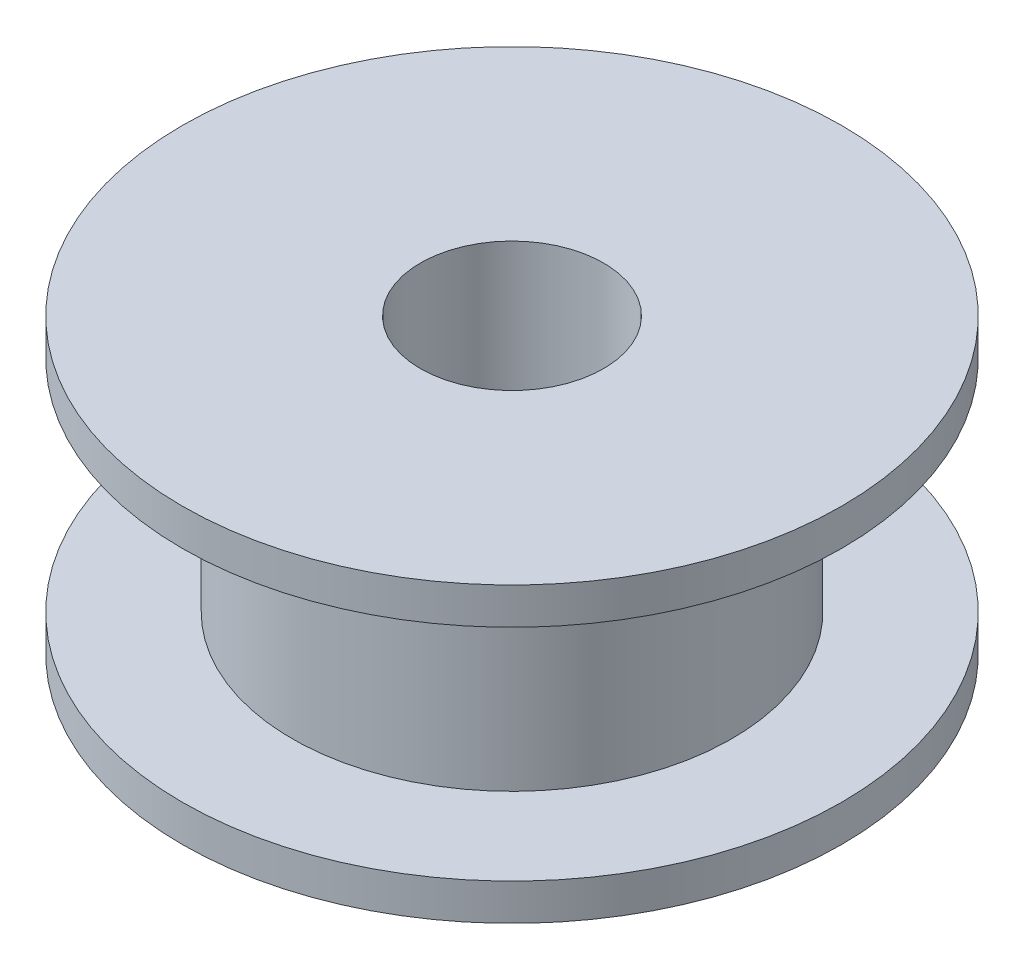
from build123d import *

# Parameters (mm, degrees)
SKETCH1_R           = 9
BOSS_EXTRUDE1_DEPTH = 8
SKETCH3_R           = 2.5
CUT_EXTRUDE1_DEPTH  = 16.033296378
SKETCH2_W           = 3
SKETCH2_H           = 6


with BuildPart() as part:
    # Sketch1 → Boss-Extrude1 (new body)
    with BuildSketch(Plane(origin=(0, 0, 0), x_dir=(1, 0, 0), z_dir=(0, 1, 0))):
        with Locations(Location((0, 0, 0), (0, 0, 270))):
            Circle(SKETCH1_R)
    extrude(amount=BOSS_EXTRUDE1_DEPTH)

    # Sketch3 → Cut-Extrude1 (cut, through all)
    with BuildSketch(Plane(origin=(0, 8, 0), x_dir=(1, 0, 0), z_dir=(0, 1, 0))):
        with Locations(Location((0, 0, 0), (0, 0, 270))):
            Circle(SKETCH3_R)
    extrude(amount=-CUT_EXTRUDE1_DEPTH, mode=Mode.SUBTRACT)

    # Sketch2 → Cut-Revolve1 (revolve, cut)
    with BuildSketch(Plane(origin=(0, 0, 0), x_dir=(0, 0, -1), z_dir=(1, 0, 0)), mode=Mode.PRIVATE) as cut_revolve1_sk:
        with Locations((-7.5, 4)):
            Rectangle(SKETCH2_W, SKETCH2_H)
    revolve(cut_revolve1_sk.sketch.rotate(Axis((0, 0, 0), (0, 1, 0)), 180), axis=Axis((0, 0, 0), (0, 1, 0)), mode=Mode.SUBTRACT)


solid = part.part
